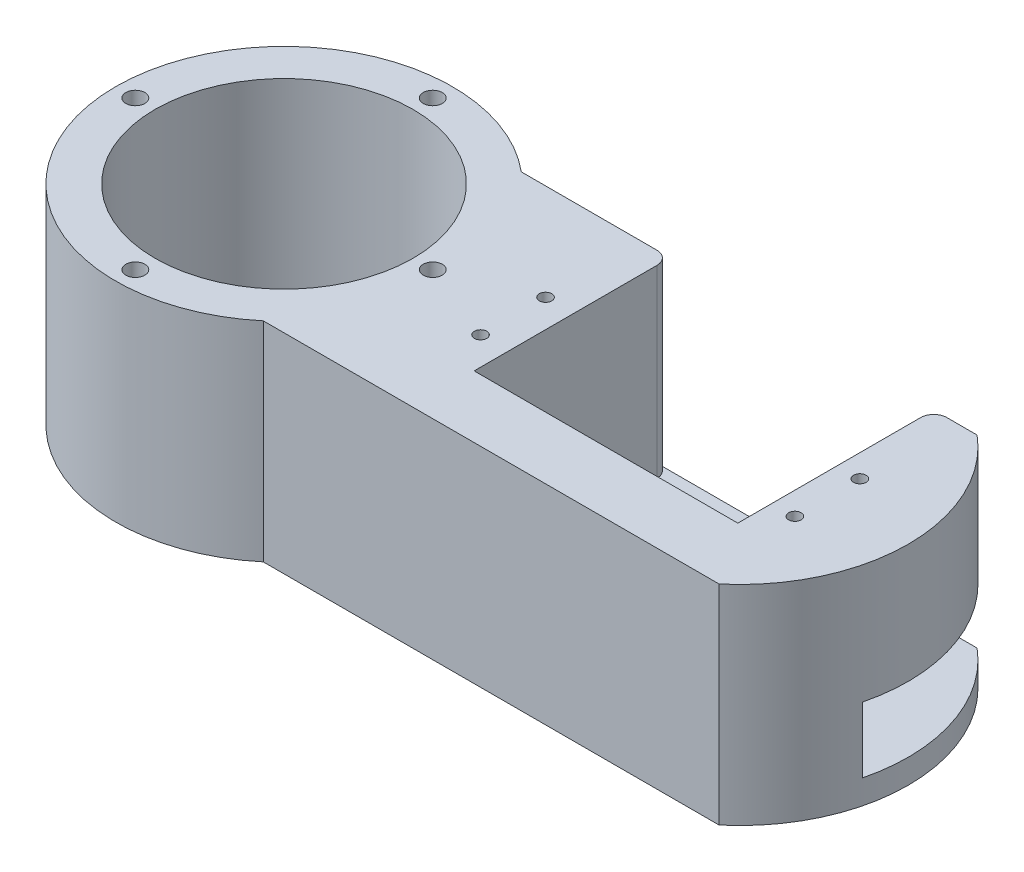
from build123d import *

# Parameters (mm, degrees)
SKETCH1_R               = 25.65
SKETCH1_R_2             = 19.65
SKETCH1_R_3             = 4
SKETCH1_R_4             = 0.95
SKETCH1_W               = 40.16
SKETCH1_H               = 20.39
BOSS_EXTRUDE2_DEPTH     = 3.7
SKETCH5_R               = 19.65
SKETCH5_W               = 40.16
SKETCH5_H               = 20.39
BOSS_EXTRUDE3_DEPTH     = 28.1
CUT_EXTRUDE1_REACH      = 108.468
SKETCH6_W               = 40.16
SKETCH6_H               = 28.1
CUT_EXTRUDE2_REACH      = 114.631
CUT_EXTRUDE2_END_RADIUS = 25.65
SKETCH7_W               = 29.863740461
SKETCH7_H               = 10
SKETCH8_R               = 1.45
CUT_EXTRUDE3_DEPTH      = 15
SKETCH9_R               = 0.95
CUT_EXTRUDE4_DEPTH      = 12
CUT_EXTRUDE5_DEPTH      = 104.481486871
FILLET1_R               = 2


with BuildPart() as part:
    # Sketch1 → Boss-Extrude2 (new body)
    # profile 1 of 6: a face of its own
    with BuildSketch(Plane(origin=(0, 0, 0), x_dir=(1, 0, 0), z_dir=(0, 1, 0))):
        Circle(SKETCH1_R)
        Circle(SKETCH1_R_2, mode=Mode.SUBTRACT)
    # profile 2 of 6: a face of its own
    with BuildSketch(Plane(origin=(0, 0, 0), x_dir=(1, 0, 0), z_dir=(0, 1, 0))):
        Circle(SKETCH1_R_2)
        with Locations(Location((0, 0, 0), (0, 0, 270))):
            Circle(SKETCH1_R_3, mode=Mode.SUBTRACT)
        with Locations(Location((16.6, 0, 0), (0, 0, 270))):
            Circle(SKETCH1_R_4, mode=Mode.SUBTRACT)
        with Locations(Location((0, -16.6, 0), (0, 0, 270))):
            Circle(SKETCH1_R_4, mode=Mode.SUBTRACT)
        with Locations(Location((-16.6, 0, 0), (0, 0, 270))):
            Circle(SKETCH1_R_4, mode=Mode.SUBTRACT)
        with Locations(Location((0, 16.6, 0), (0, 0, 270))):
            Circle(SKETCH1_R_4, mode=Mode.SUBTRACT)
    # profile 3 of 6: a face of its own
    with BuildSketch(Plane(origin=(0, 0, 0), x_dir=(1, 0, 0), z_dir=(0, 1, 0))):
        with BuildLine():
            Line((30.65, 18.695), (86.986875612, 18.695))
            ThreePointArc((86.986875612, 18.695), (78.869462663, 23.847948025), (69.425, 25.65))
            Line((69.425, 25.65), (0, 25.65))
            ThreePointArc((0, 25.65), (18.137288937, 18.137288937), (25.65, 0))
            ThreePointArc((25.65, 0), (18.137288937, -18.137288937), (0, -25.65))
            Line((0, -25.65), (69.425, -25.65))
            ThreePointArc((69.425, -25.65), (78.869462663, -23.847948025), (86.986875612, -18.695))
            Line((86.986875612, -18.695), (30.65, -18.695))
            Line((30.65, -18.695), (30.65, 18.695))
        make_face()
    # profile 4 of 6: a face of its own
    with BuildSketch(Plane(origin=(0, 0, 0), x_dir=(1, 0, 0), z_dir=(0, 1, 0))):
        with BuildLine():
            Line((87.81, -17.886147573), (87.81, 17.886147573))
            ThreePointArc((87.81, 17.886147573), (87.402987293, 18.295203548), (86.986875612, 18.695))
            Line((86.986875612, 18.695), (30.65, 18.695))
            Line((30.65, 18.695), (30.65, -18.695))
            Line((30.65, -18.695), (86.986875612, -18.695))
            ThreePointArc((86.986875612, -18.695), (87.402987293, -18.295203548), (87.81, -17.886147573))
        make_face()
        with Locations((59.23, 0)):
            Rectangle(SKETCH1_W, SKETCH1_H, mode=Mode.SUBTRACT)
    # profile 5 of 6: a face of its own
    with BuildSketch(Plane(origin=(0, 0, 0), x_dir=(1, 0, 0), z_dir=(0, 1, 0))):
        with Locations((59.23, 0)):
            Rectangle(SKETCH1_W, SKETCH1_H)
    # profile 6 of 6: a face of its own
    with BuildSketch(Plane(origin=(0, 0, 0), x_dir=(1, 0, 0), z_dir=(0, 1, 0))):
        with BuildLine():
            ThreePointArc((87.81, -17.886147573), (95.075, 0), (87.81, 17.886147573))
            Line((87.81, 17.886147573), (87.81, -17.886147573))
        make_face()
    extrude(amount=BOSS_EXTRUDE2_DEPTH)

    # Sketch5 → Boss-Extrude3 (add)
    # profile 1 of 4: a face of its own
    with BuildSketch(Plane(origin=(0, 3.7, 0), x_dir=(1, 0, 0), z_dir=(0, 1, 0))):
        with BuildLine():
            ThreePointArc((25.65, 0), (18.137288937, 18.137288937), (0, 25.65))
            ThreePointArc((0, 25.65), (-25.65, 0), (0, -25.65))
            ThreePointArc((0, -25.65), (18.137288937, -18.137288937), (25.65, 0))
        make_face()
        with Locations(Location((0, 0, 0), (0, 0, 270))):
            Circle(SKETCH5_R, mode=Mode.SUBTRACT)
    # profile 2 of 4: a face of its own
    with BuildSketch(Plane(origin=(0, 3.7, 0), x_dir=(1, 0, 0), z_dir=(0, 1, 0))):
        with BuildLine():
            ThreePointArc((87.81, 17.886147573), (87.402987293, 18.295203548), (86.986875612, 18.695))
            Line((86.986875612, 18.695), (30.65, 18.695))
            Line((30.65, 18.695), (30.65, -18.695))
            Line((30.65, -18.695), (86.986875612, -18.695))
            ThreePointArc((86.986875612, -18.695), (87.402987293, -18.295203548), (87.81, -17.886147573))
            Line((87.81, -17.886147573), (87.81, 17.886147573))
        make_face()
        with Locations((59.23, 0)):
            Rectangle(SKETCH5_W, SKETCH5_H, mode=Mode.SUBTRACT)
    # profile 3 of 4: a face of its own
    with BuildSketch(Plane(origin=(0, 3.7, 0), x_dir=(1, 0, 0), z_dir=(0, 1, 0))):
        with BuildLine():
            ThreePointArc((86.986875612, 18.695), (78.869462663, 23.847948025), (69.425, 25.65))
            Line((69.425, 25.65), (0, 25.65))
            ThreePointArc((0, 25.65), (18.137288937, 18.137288937), (25.65, 0))
            ThreePointArc((25.65, 0), (18.137288937, -18.137288937), (0, -25.65))
            Line((0, -25.65), (69.425, -25.65))
            ThreePointArc((69.425, -25.65), (78.869462663, -23.847948025), (86.986875612, -18.695))
            Line((86.986875612, -18.695), (30.65, -18.695))
            Line((30.65, -18.695), (30.65, 18.695))
            Line((30.65, 18.695), (86.986875612, 18.695))
        make_face()
    # profile 4 of 4: a face of its own
    with BuildSketch(Plane(origin=(0, 3.7, 0), x_dir=(1, 0, 0), z_dir=(0, 1, 0))):
        with BuildLine():
            ThreePointArc((87.81, -17.886147573), (95.075, 0), (87.81, 17.886147573))
            Line((87.81, 17.886147573), (87.81, -17.886147573))
        make_face()
    extrude(amount=BOSS_EXTRUDE3_DEPTH)

    # Sketch6 → Cut-Extrude1 (cut, up to next)
    with BuildSketch(Plane.XY.offset(-10.195), mode=Mode.PRIVATE) as cut_extrude1_sk1:
        with Locations((59.23, 17.75)):
            Rectangle(SKETCH6_W, SKETCH6_H)
    cut_extrude1_tool1 = extrude(cut_extrude1_sk1.sketch, amount=-CUT_EXTRUDE1_REACH, mode=Mode.PRIVATE) & part.part
    add(cut_extrude1_tool1.solids().sort_by_distance((59.23, 17.75, -10.195))[0], mode=Mode.SUBTRACT)

    # Cut-Extrude2: up to this cylinder (the profile starts inside it)
    cut_extrude2_end = Plane(origin=(69.425, 8.7, 0), z_dir=(0, -1, 0)) * Cylinder(CUT_EXTRUDE2_END_RADIUS, 281.562, mode=Mode.PRIVATE)
    # Sketch7 → Cut-Extrude2 (cut, up to the surface)
    with BuildSketch(Plane.ZY.offset(-79.31), mode=Mode.PRIVATE) as cut_extrude2_sk1:
        with Locations((-8.736870231, 8.7)):
            Rectangle(SKETCH7_W, SKETCH7_H)
    cut_extrude2_tool1 = extrude(cut_extrude2_sk1.sketch, amount=-CUT_EXTRUDE2_REACH, mode=Mode.PRIVATE) & cut_extrude2_end
    add(cut_extrude2_tool1.solids().sort_by_distance((79.31, 8.7, -8.73687))[0], mode=Mode.SUBTRACT)

    # Sketch8 → Cut-Extrude3 (cut)
    with BuildSketch(Plane(origin=(0, 31.8, 0), x_dir=(1, 0, 0), z_dir=(0, 1, 0))):
        with Locations(Location((22.65, 0, 0), (0, 0, 270))):
            Circle(SKETCH8_R)
        with Locations(Location((0, -22.65, 0), (0, 0, 270))):
            Circle(SKETCH8_R)
        with Locations(Location((-22.65, 0, 0), (0, 0, 270))):
            Circle(SKETCH8_R)
        with Locations(Location((0, 22.65, 0), (0, 0, 270))):
            Circle(SKETCH8_R)
    extrude(amount=-CUT_EXTRUDE3_DEPTH, mode=Mode.SUBTRACT)

    # Sketch9 → Cut-Extrude4 (cut)
    with BuildSketch(Plane(origin=(0, 31.8, 0), x_dir=(1, 0, 0), z_dir=(0, 1, 0))):
        with Locations(Location((34.88, -4.95, 0), (0, 0, 270))):
            Circle(SKETCH9_R)
        with Locations(Location((34.88, 4.95, 0), (0, 0, 90))):
            Circle(SKETCH9_R)
        with Locations(Location((82.756875612, -4.95, 0), (0, 0, 90))):
            Circle(SKETCH9_R)
        with Locations(Location((82.756875612, 4.95, 0), (0, 0, 270))):
            Circle(SKETCH9_R)
    extrude(amount=-CUT_EXTRUDE4_DEPTH, mode=Mode.SUBTRACT)

    # Sketch12 → Cut-Extrude5 (cut, through all)
    with BuildSketch(Plane(origin=(0, 31.8, 0), x_dir=(1, 0, 0), z_dir=(0, 1, 0))):
        with BuildLine():
            Line((0, 25.65), (69.425, 25.65))
            ThreePointArc((69.425, 25.65), (78.19711491, 24.103371134), (85.911357997, 19.65))
            Line((85.911357997, 19.65), (16.486357997, 19.65))
            ThreePointArc((16.486357997, 19.65), (8.77211491, 24.103371134), (0, 25.65))
        make_face()
        with BuildLine():
            Line((0, -25.65), (69.425, -25.65))
            ThreePointArc((69.425, -25.65), (78.19711491, -24.103371134), (85.911357997, -19.65))
            Line((85.911357997, -19.65), (16.486357997, -19.65))
            ThreePointArc((16.486357997, -19.65), (8.77211491, -24.103371134), (0, -25.65))
        make_face()
    extrude(amount=-CUT_EXTRUDE5_DEPTH, mode=Mode.SUBTRACT)

    # Fillet1
    fillet1_edges = [part.edges().sort_by_distance(p)[0] for p in [
        (39.15, 17.75, -19.65),
        (79.31, 22.75, -19.65),
    ]]
    fillet(fillet1_edges, radius=FILLET1_R)


solid = part.part
